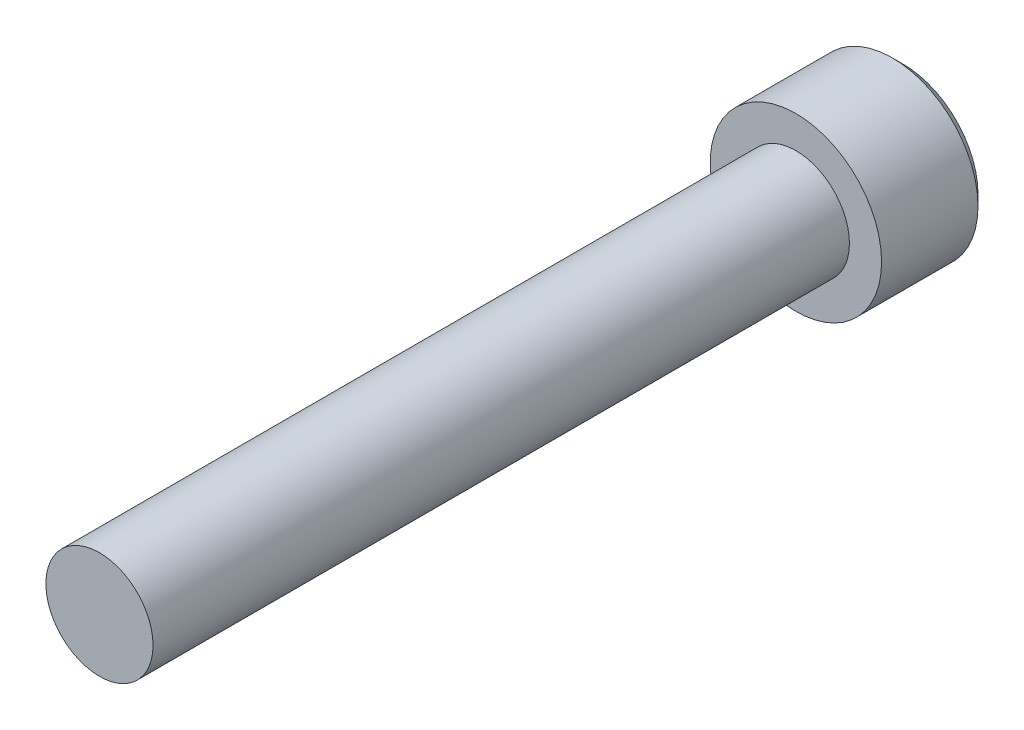
from build123d import *

# Parameters (mm, degrees)
SKETCH_1_R      = 5
EXTRUDE_1_DEPTH = 65
SKETCH_1_3_R    = 8
EXTRUDE_2_DEPTH = 10
CHAMFER_1_SIZE  = 1


with BuildPart() as part:
    # 草图1 → 凸台-拉伸1 (new body)
    with BuildSketch(Plane.XY):
        Circle(SKETCH_1_R)
    extrude(amount=EXTRUDE_1_DEPTH)

    # 草图1<3> → 凸台-拉伸2 (add)
    with BuildSketch(Plane.XY):
        Circle(SKETCH_1_3_R)
    extrude(amount=-EXTRUDE_2_DEPTH)

    # 倒角1
    chamfer_1_edges = [part.edges().sort_by_distance(p)[0] for p in [
        (-8, 0, -10),
    ]]
    chamfer(chamfer_1_edges, length=CHAMFER_1_SIZE)


solid = part.part
